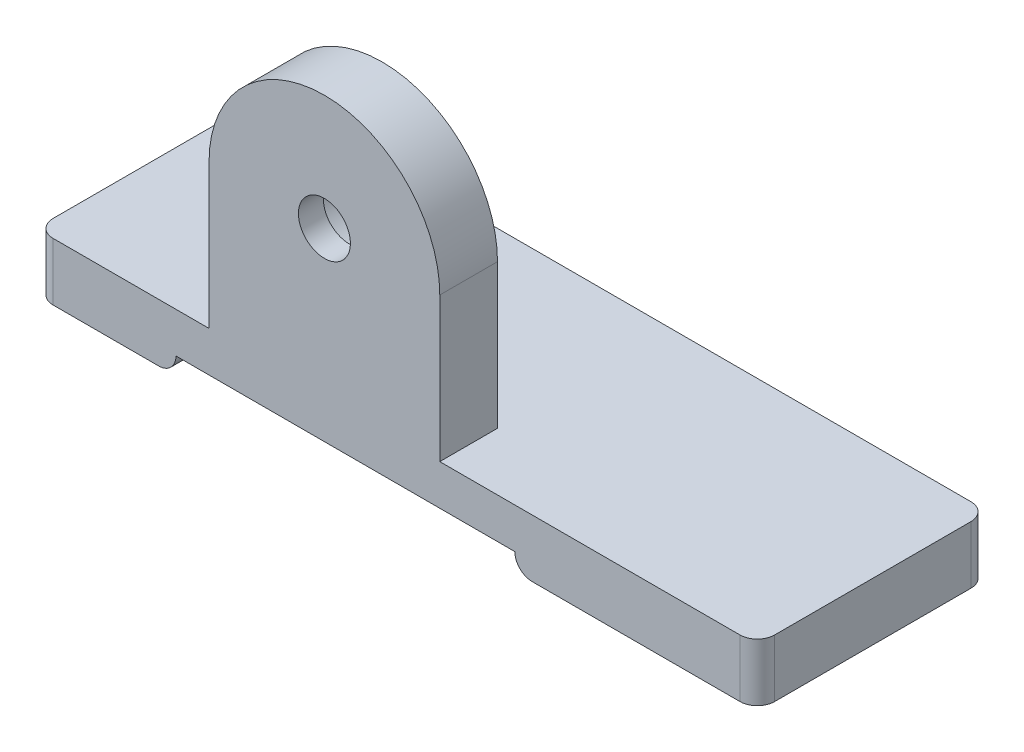
from build123d import *

# Parameters (mm, degrees)
SKETCH1_W                               = 125
SKETCH1_H                               = 40
BOSS_EXTRUDE1_DEPTH                     = 10
BOSS_EXTRUDE2_DEPTH                     = 10
SKETCH9_W                               = 58.70504164
SKETCH9_H                               = 3.000259145
CUT_EXTRUDE1_DEPTH                      = 67
FILLET1_R                               = 3
FILLET2_R                               = 3
CBORE_FOR_M8_HEX_HEAD_BOLT1_D           = 9
CBORE_FOR_M8_HEX_HEAD_BOLT1_CBORE_D     = 18.01
CBORE_FOR_M8_HEX_HEAD_BOLT1_CBORE_DEPTH = 5.68


with BuildPart() as part:
    # Sketch1 → Boss-Extrude1 (new body)
    with BuildSketch(Plane(origin=(0, 0, 0), x_dir=(1, 0, 0), z_dir=(0, 1, 0))):
        with Locations((62.5, 20)):
            Rectangle(SKETCH1_W, SKETCH1_H)
    extrude(amount=BOSS_EXTRUDE1_DEPTH)

    # Sketch4 → Boss-Extrude2 (add)
    with BuildSketch(Plane.XY):
        with BuildLine():
            Line((30.012948081, 0), (69.987051919, 0))
            Line((69.987051919, 0), (69.987051919, 35))
            ThreePointArc((69.987051919, 35), (50, 54.987051919), (30.012948081, 35))
            Line((30.012948081, 35), (30.012948081, 0))
        make_face()
    extrude(amount=-BOSS_EXTRUDE2_DEPTH)

    # Sketch9 → Cut-Extrude1 (cut)
    with BuildSketch(Plane.XY):
        with Locations((53.635144719, 1.500129573)):
            Rectangle(SKETCH9_W, SKETCH9_H)
    extrude(amount=-CUT_EXTRUDE1_DEPTH, mode=Mode.SUBTRACT)

    # Fillet1
    fillet1_edges = [part.edges().sort_by_distance(p)[0] for p in [
        (0, 5, 0),
        (125, 5, 0),
        (125, 5, -40),
        (0, 5, -40),
    ]]
    fillet(fillet1_edges, radius=FILLET1_R)

    # Fillet2
    fillet2_edges = [part.edges().sort_by_distance(p)[0] for p in [
        (82.987665539, 0, -20),
        (24.282623899, 0, -20),
    ]]
    fillet(fillet2_edges, radius=FILLET2_R)

    # CBORE for M8 Hex Head Bolt1 (through all)
    with Locations(Plane(origin=(50, 35, -10), x_dir=(-1, 0, 0), z_dir=(0, 0, -1))):
        with Locations((0, 0)):
            CounterBoreHole(CBORE_FOR_M8_HEX_HEAD_BOLT1_D / 2, CBORE_FOR_M8_HEX_HEAD_BOLT1_CBORE_D / 2, CBORE_FOR_M8_HEX_HEAD_BOLT1_CBORE_DEPTH)


solid = part.part
